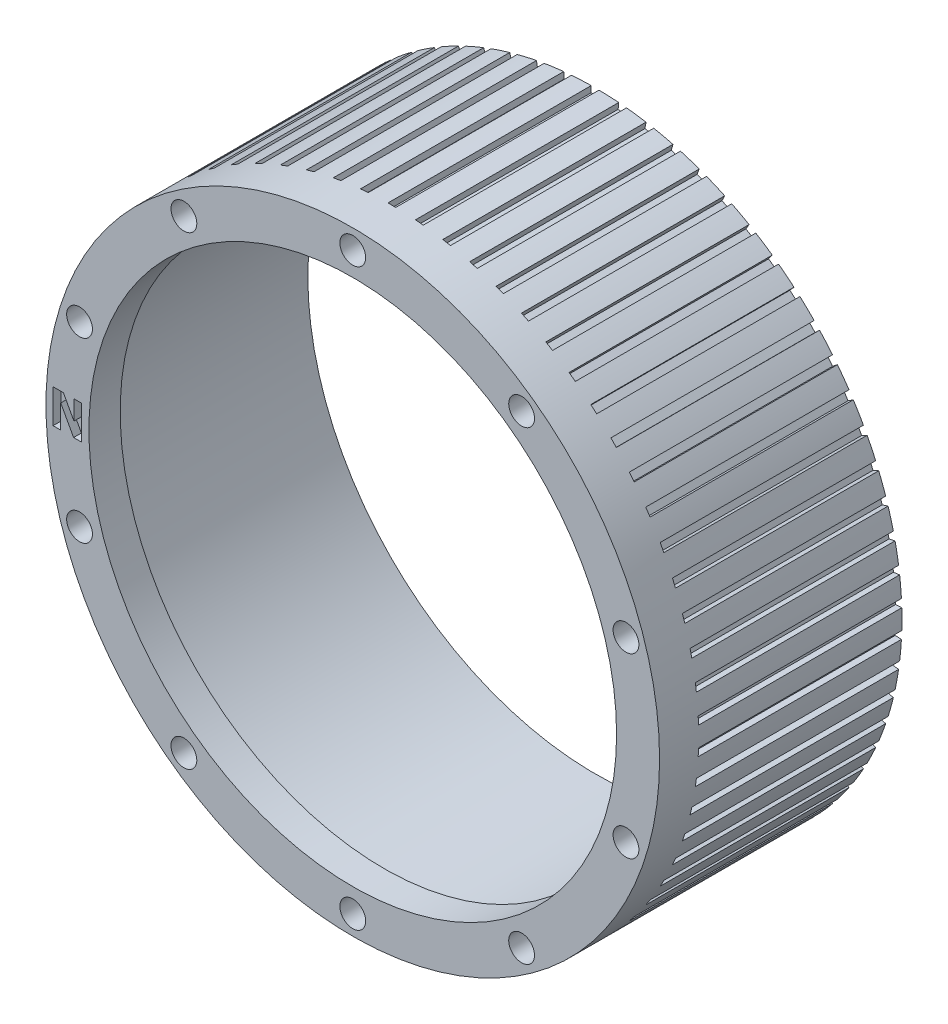
from build123d import *

# Parameters (mm, degrees)
SKETCH1_R           = 39.25
BOSS_EXTRUDE1_DEPTH = 31
SKETCH2_R           = 36.75
CUT_EXTRUDE1_DEPTH  = 27
SKETCH3_R           = 33.75
CUT_EXTRUDE2_DEPTH  = 4
SKETCH4_R           = 1.65
CUT_EXTRUDE3_DEPTH  = 3
SKETCH5_W           = 1
SKETCH5_H           = 0.8
CUT_EXTRUDE4_DEPTH  = 26
CUT_EXTRUDE5_DEPTH  = 1


with BuildPart() as part:
    # Sketch1 → Boss-Extrude1 (new body)
    with BuildSketch(Plane.XY):
        Circle(SKETCH1_R)
    extrude(amount=BOSS_EXTRUDE1_DEPTH)

    # Sketch2 → Cut-Extrude1 (cut)
    with BuildSketch(Plane(origin=(0, 0, 0), x_dir=(-1, 0, 0), z_dir=(0, 0, -1))):
        Circle(SKETCH2_R)
    extrude(amount=-CUT_EXTRUDE1_DEPTH, mode=Mode.SUBTRACT)

    # Sketch3 → Cut-Extrude2 (cut)
    with BuildSketch(Plane.XY.offset(31)):
        Circle(SKETCH3_R)
    extrude(amount=-CUT_EXTRUDE2_DEPTH, mode=Mode.SUBTRACT)

    # Sketch4 → Cut-Extrude3 (cut)
    with BuildSketch(Plane.XY.offset(31)):
        with Locations((-34.951326974, -11.356374543)):
            Circle(SKETCH4_R)
        with Locations((-34.951326974, 11.356374543)):
            Circle(SKETCH4_R)
        with Locations((-21.601108022, 29.731374543)):
            Circle(SKETCH4_R)
        with Locations((0, 36.75)):
            Circle(SKETCH4_R)
        with Locations((21.601108022, 29.731374543)):
            Circle(SKETCH4_R)
        with Locations((34.951326974, 11.356374543)):
            Circle(SKETCH4_R)
        with Locations((34.951326974, -11.356374543)):
            Circle(SKETCH4_R)
        with Locations((21.601108022, -29.731374543)):
            Circle(SKETCH4_R)
        with Locations((0, -36.75)):
            Circle(SKETCH4_R)
        with Locations((-21.601108022, -29.731374543)):
            Circle(SKETCH4_R)
    extrude(amount=-CUT_EXTRUDE3_DEPTH, mode=Mode.SUBTRACT)

    # Sketch5 → Cut-Extrude4 (cut)
    with BuildSketch(Plane(origin=(0, 0, 0), x_dir=(-1, 0, 0), z_dir=(0, 0, -1))):
        with Locations((0, 38.85)):
            Rectangle(SKETCH5_W, SKETCH5_H)
        Polygon((3.020355727, 39.136810694), (2.94864428, 38.340031259), (3.944618574, 38.25039195), (4.016330021, 39.047171385), align=None)
        Polygon((6.516393327, 38.7085148), (6.373547811, 37.921371129), (7.357477399, 37.742814234), (7.500322915, 38.529957905), align=None)
        Polygon((9.959964758, 37.968560705), (9.747135282, 37.197390417), (10.711098142, 36.931353571), (10.923927619, 37.70252386), align=None)
        Polygon((13.32334441, 36.922906085), (13.042244551, 36.173918188), (13.978479421, 35.822543364), (14.259579281, 36.571531261), align=None)
        Polygon((16.579452326, 35.579969935), (16.232345335, 34.85919484), (17.133314203, 34.425311101), (17.480421194, 35.146086196), align=None)
        Polygon((19.702072241, 33.950564788), (19.291752819, 33.263805753), (20.150201613, 32.750906475), (20.560521035, 33.43766551), align=None)
        Polygon((22.666062655, 32.047809655), (22.195834453, 31.40059606), (23.004851448, 30.812810808), (23.47507965, 31.460024403), align=None)
        Polygon((25.44755926, 29.887024404), (24.921208279, 29.284567231), (25.674279745, 28.626628505), (26.200630726, 29.229085678), align=None)
        Polygon((28.024167081, 27.485606405), (27.44593119, 26.932756285), (28.136993839, 26.209961422), (28.71522973, 26.762811541), align=None)
        Polygon((30.375140786, 24.862890464), (29.7496756, 24.364098623), (30.373165402, 23.58226714), (30.998630588, 24.081058982), align=None)
        Polygon((32.481551718, 22.039993149), (31.813893115, 21.599275564), (32.364790096, 20.76470231), (33.032448699, 21.205419895), align=None)
        Polygon((34.326440294, 19.039642768), (33.621963869, 18.660547838), (34.095832531, 17.779952306), (34.800308957, 18.159047236), align=None)
        Polygon((35.894952557, 15.885996379), (35.159330339, 15.571576353), (35.55235537, 14.652048581), (36.287977588, 14.966468606), align=None)
        Polygon((37.174459767, 12.604445287), (36.413614554, 12.357231692), (36.722631549, 11.406175176), (37.483476762, 11.653388771), align=None)
        Polygon((38.154660086, 9.221410614), (37.374717756, 9.043393867), (37.59723869, 8.068465955), (38.37718102, 8.246482702), align=None)
        Polygon((38.827661516, 5.764130564), (38.034901707, 5.656743952), (38.169134973, 4.66579419), (38.961894782, 4.773180802), align=None)
        Polygon((39.188045447, 2.260441125), (38.388850993, 2.22454926), (38.433715824, 1.225556194), (39.232910277, 1.261448058), align=None)
        Polygon((39.232910277, -1.261448058), (38.433715824, -1.225556194), (38.388850993, -2.22454926), (39.188045447, -2.260441125), align=None)
        Polygon((38.961894782, -4.773180802), (38.169134973, -4.66579419), (38.034901707, -5.656743952), (38.827661516, -5.764130564), align=None)
        Polygon((38.37718102, -8.246482702), (37.59723869, -8.068465955), (37.374717756, -9.043393867), (38.154660086, -9.221410614), align=None)
        Polygon((37.483476762, -11.653388771), (36.722631549, -11.406175176), (36.413614554, -12.357231692), (37.174459767, -12.604445287), align=None)
        Polygon((36.287977588, -14.966468606), (35.55235537, -14.652048581), (35.159330339, -15.571576353), (35.894952557, -15.885996379), align=None)
        Polygon((34.800308957, -18.159047236), (34.095832531, -17.779952306), (33.621963869, -18.660547838), (34.326440294, -19.039642768), align=None)
        Polygon((33.032448699, -21.205419895), (32.364790096, -20.76470231), (31.813893115, -21.599275564), (32.481551718, -22.039993149), align=None)
        Polygon((30.998630588, -24.081058982), (30.373165402, -23.58226714), (29.7496756, -24.364098623), (30.375140786, -24.862890464), align=None)
        Polygon((28.71522973, -26.762811541), (28.136993839, -26.209961422), (27.44593119, -26.932756285), (28.024167081, -27.485606405), align=None)
        Polygon((26.200630726, -29.229085678), (25.674279745, -28.626628505), (24.921208279, -29.284567231), (25.44755926, -29.887024404), align=None)
        Polygon((23.47507965, -31.460024403), (23.004851448, -30.812810808), (22.195834453, -31.40059606), (22.666062655, -32.047809655), align=None)
        Polygon((20.560521035, -33.43766551), (20.150201613, -32.750906475), (19.291752819, -33.263805753), (19.702072241, -33.950564788), align=None)
        Polygon((17.480421194, -35.146086196), (17.133314203, -34.425311101), (16.232345335, -34.85919484), (16.579452326, -35.579969935), align=None)
        Polygon((14.259579281, -36.571531261), (13.978479421, -35.822543364), (13.042244551, -36.173918188), (13.32334441, -36.922906085), align=None)
        Polygon((10.923927619, -37.70252386), (10.711098142, -36.931353571), (9.747135282, -37.197390417), (9.959964758, -37.968560705), align=None)
        Polygon((7.500322915, -38.529957905), (7.357477399, -37.742814234), (6.373547811, -37.921371129), (6.516393327, -38.7085148), align=None)
        Polygon((4.016330021, -39.047171385), (3.944618574, -38.25039195), (2.94864428, -38.340031259), (3.020355727, -39.136810694), align=None)
        with Locations((0, -38.85)):
            Rectangle(SKETCH5_W, SKETCH5_H)
        Polygon((-3.020355727, -39.136810694), (-2.94864428, -38.340031259), (-3.944618574, -38.25039195), (-4.016330021, -39.047171385), align=None)
        Polygon((-6.516393327, -38.7085148), (-6.373547811, -37.921371129), (-7.357477399, -37.742814234), (-7.500322915, -38.529957905), align=None)
        Polygon((-9.959964758, -37.968560705), (-9.747135282, -37.197390417), (-10.711098142, -36.931353571), (-10.923927619, -37.70252386), align=None)
        Polygon((-13.32334441, -36.922906085), (-13.042244551, -36.173918188), (-13.978479421, -35.822543364), (-14.259579281, -36.571531261), align=None)
        Polygon((-16.579452326, -35.579969935), (-16.232345335, -34.85919484), (-17.133314203, -34.425311101), (-17.480421194, -35.146086196), align=None)
        Polygon((-19.702072241, -33.950564788), (-19.291752819, -33.263805753), (-20.150201613, -32.750906475), (-20.560521035, -33.43766551), align=None)
        Polygon((-22.666062655, -32.047809655), (-22.195834453, -31.40059606), (-23.004851448, -30.812810808), (-23.47507965, -31.460024403), align=None)
        Polygon((-25.44755926, -29.887024404), (-24.921208279, -29.284567231), (-25.674279745, -28.626628505), (-26.200630726, -29.229085678), align=None)
        Polygon((-28.024167081, -27.485606405), (-27.44593119, -26.932756285), (-28.136993839, -26.209961422), (-28.71522973, -26.762811541), align=None)
        Polygon((-30.375140786, -24.862890464), (-29.7496756, -24.364098623), (-30.373165402, -23.58226714), (-30.998630588, -24.081058982), align=None)
        Polygon((-32.481551718, -22.039993149), (-31.813893115, -21.599275564), (-32.364790096, -20.76470231), (-33.032448699, -21.205419895), align=None)
        Polygon((-34.326440294, -19.039642768), (-33.621963869, -18.660547838), (-34.095832531, -17.779952306), (-34.800308957, -18.159047236), align=None)
        Polygon((-35.894952557, -15.885996379), (-35.159330339, -15.571576353), (-35.55235537, -14.652048581), (-36.287977588, -14.966468606), align=None)
        Polygon((-37.174459767, -12.604445287), (-36.413614554, -12.357231692), (-36.722631549, -11.406175176), (-37.483476762, -11.653388771), align=None)
        Polygon((-38.154660086, -9.221410614), (-37.374717756, -9.043393867), (-37.59723869, -8.068465955), (-38.37718102, -8.246482702), align=None)
        Polygon((-38.827661516, -5.764130564), (-38.034901707, -5.656743952), (-38.169134973, -4.66579419), (-38.961894782, -4.773180802), align=None)
        Polygon((-39.188045447, -2.260441125), (-38.388850993, -2.22454926), (-38.433715824, -1.225556194), (-39.232910277, -1.261448058), align=None)
        Polygon((-39.232910277, 1.261448058), (-38.433715824, 1.225556194), (-38.388850993, 2.22454926), (-39.188045447, 2.260441125), align=None)
        Polygon((-38.961894782, 4.773180802), (-38.169134973, 4.66579419), (-38.034901707, 5.656743952), (-38.827661516, 5.764130564), align=None)
        Polygon((-38.37718102, 8.246482702), (-37.59723869, 8.068465955), (-37.374717756, 9.043393867), (-38.154660086, 9.221410614), align=None)
        Polygon((-37.483476762, 11.653388771), (-36.722631549, 11.406175176), (-36.413614554, 12.357231692), (-37.174459767, 12.604445287), align=None)
        Polygon((-36.287977588, 14.966468606), (-35.55235537, 14.652048581), (-35.159330339, 15.571576353), (-35.894952557, 15.885996379), align=None)
        Polygon((-34.800308957, 18.159047236), (-34.095832531, 17.779952306), (-33.621963869, 18.660547838), (-34.326440294, 19.039642768), align=None)
        Polygon((-33.032448699, 21.205419895), (-32.364790096, 20.76470231), (-31.813893115, 21.599275564), (-32.481551718, 22.039993149), align=None)
        Polygon((-30.998630588, 24.081058982), (-30.373165402, 23.58226714), (-29.7496756, 24.364098623), (-30.375140786, 24.862890464), align=None)
        Polygon((-28.71522973, 26.762811541), (-28.136993839, 26.209961422), (-27.44593119, 26.932756285), (-28.024167081, 27.485606405), align=None)
        Polygon((-26.200630726, 29.229085678), (-25.674279745, 28.626628505), (-24.921208279, 29.284567231), (-25.44755926, 29.887024404), align=None)
        Polygon((-23.47507965, 31.460024403), (-23.004851448, 30.812810808), (-22.195834453, 31.40059606), (-22.666062655, 32.047809655), align=None)
        Polygon((-20.560521035, 33.43766551), (-20.150201613, 32.750906475), (-19.291752819, 33.263805753), (-19.702072241, 33.950564788), align=None)
        Polygon((-17.480421194, 35.146086196), (-17.133314203, 34.425311101), (-16.232345335, 34.85919484), (-16.579452326, 35.579969935), align=None)
        Polygon((-14.259579281, 36.571531261), (-13.978479421, 35.822543364), (-13.042244551, 36.173918188), (-13.32334441, 36.922906085), align=None)
        Polygon((-10.923927619, 37.70252386), (-10.711098142, 36.931353571), (-9.747135282, 37.197390417), (-9.959964758, 37.968560705), align=None)
        Polygon((-7.500322915, 38.529957905), (-7.357477399, 37.742814234), (-6.373547811, 37.921371129), (-6.516393327, 38.7085148), align=None)
        Polygon((-4.016330021, 39.047171385), (-3.944618574, 38.25039195), (-2.94864428, 38.340031259), (-3.020355727, 39.136810694), align=None)
    extrude(amount=-CUT_EXTRUDE4_DEPTH, mode=Mode.SUBTRACT)

    # Sketch6 → Cut-Extrude5 (cut)
    with BuildSketch(Plane.XY.offset(31)):
        Polygon((-34.678341082, -1.84903576), (-35.712955587, -1.84903576), (-37.355363431, 1.160053457), (-37.355363431, -1.84903576), (-38.338759397, -1.84903576), (-38.338759397, 2.466979865), (-37.020735638, 2.466979865), (-35.661737047, -0.005168325), (-35.661737047, 2.466979865), (-34.678341082, 2.466979865), align=None)
    extrude(amount=-CUT_EXTRUDE5_DEPTH, mode=Mode.SUBTRACT)


solid = part.part
